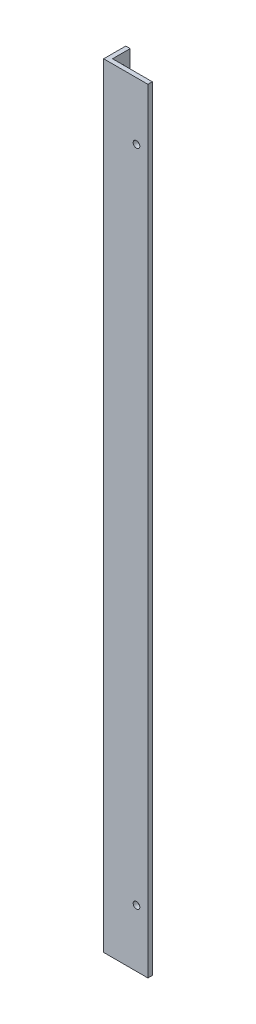
from build123d import *

# Parameters (mm, degrees)
BOSS_EXTRUDE1_DEPTH          = 350
F_3_0_3_DIAMETER_SLOT1_D     = 3
F_3_0_3_DIAMETER_HOLE2_D     = 3
F_3_0_3_DIAMETER_HOLE2_DEPTH = 4


with BuildPart() as part:
    # Sketch1 → Boss-Extrude1 (new body)
    with BuildSketch(Plane(origin=(0, 0, 0), x_dir=(1, 0, 0), z_dir=(0, 1, 0))):
        Polygon((0, 0), (0, 10), (2, 10), (2, 2), (20, 2), (20, 0), align=None)
    extrude(amount=BOSS_EXTRUDE1_DEPTH)

    # Ø3.0 (3) Diameter Slot1 (through all)
    with Locations(Plane.XY):
        with Locations((14.838501141, 25.910104069), (14.838501141, 323.866264903)):
            Hole(F_3_0_3_DIAMETER_SLOT1_D / 2)

    # Ø3.0 (3) Diameter Hole2
    with Locations(Plane(origin=(0, 128.861996081, -176.67995168), x_dir=(0, 1, 0), z_dir=(-1, 0, 0))):
        with Locations((-122.861996081, -170.67995168), (-108.861996081, -170.67995168), (215.138003919, -170.67995168), (201.138003919, -170.67995168)):
            Hole(F_3_0_3_DIAMETER_HOLE2_D / 2, depth=F_3_0_3_DIAMETER_HOLE2_DEPTH)


solid = part.part
